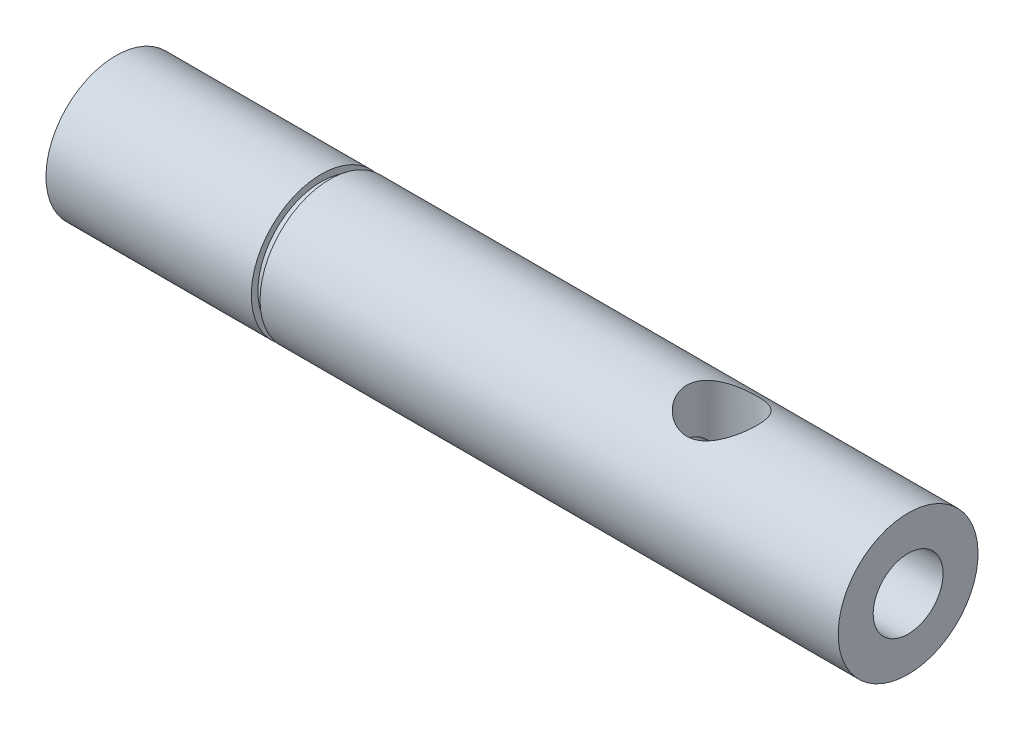
from build123d import *

# Parameters (mm, degrees)
SKETCH2_R          = 4.7625
CUT_EXTRUDE1_DEPTH = 7.62
SKETCH3_W          = 1.1913435
SKETCH3_H          = 1.782578162


with BuildPart() as part:
    # Sketch1 → Revolve1 (revolve)
    with BuildSketch(Plane.XY):
        Polygon((53.975, 9.525), (-53.975, 9.525), (-53.975, 6.985), (-35.940357238, 6.985), (-27.793652955, 3.156048987), (29.734276459, 3.156048987), (35.24717222, 4.7625), (53.975, 4.7625), align=None)
    revolve(axis=Axis((-53.975, 0, 0), (1, 0, 0)))

    # Sketch2 → Cut-Extrude1 (cut)
    with BuildSketch(Plane(origin=(0, 9.525, 0), x_dir=(1, 0, 0), z_dir=(0, 1, 0))):
        with Locations((28.575, 0)):
            Circle(SKETCH2_R)
    extrude(amount=-CUT_EXTRUDE1_DEPTH, mode=Mode.SUBTRACT)

    # Sketch3 → Cut-Revolve1 (revolve, cut)
    with BuildSketch(Plane(origin=(0, 0, 0), x_dir=(1, 0, 0), z_dir=(0, 1, 0))):
        with Locations((-25.4, 9.525)):
            Rectangle(SKETCH3_W, SKETCH3_H)
    revolve(axis=Axis((-53.975, 0, 0), (1, 0, 0)), mode=Mode.SUBTRACT)


solid = part.part
